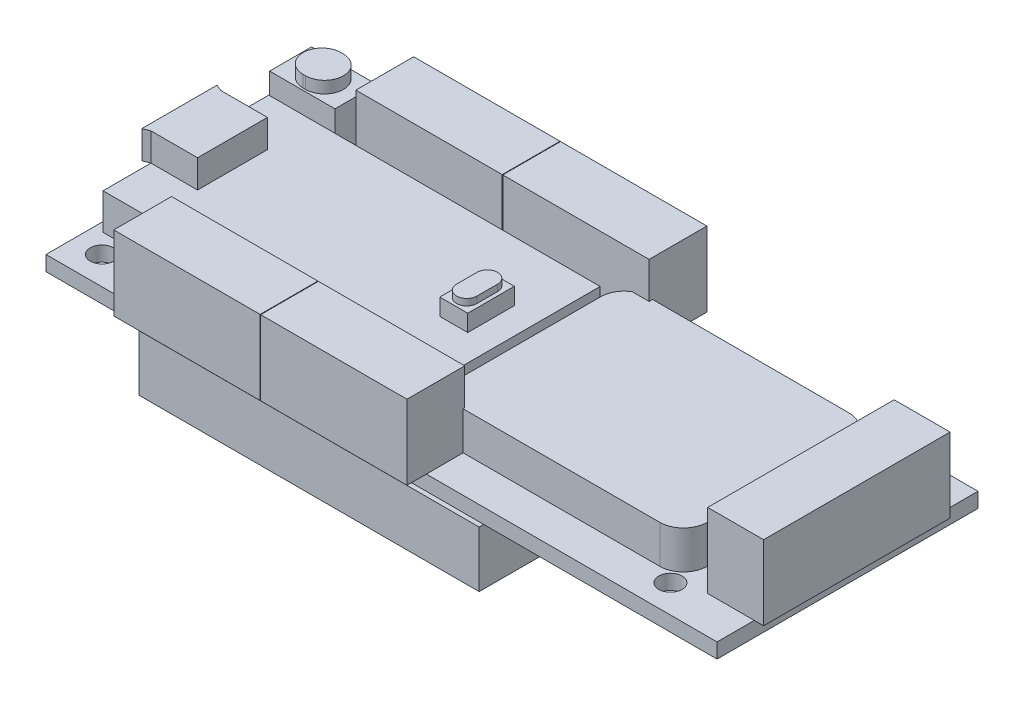
from build123d import *

# Parameters (mm, degrees)
SKETCH1_W            = 72
SKETCH1_H            = 28
SKETCH1_R            = 1.25
SKETCH1_R_2          = 0.5
BOSS_EXTRUDE1_DEPTH  = 1.6
SKETCH2_W            = 35.56
SKETCH2_H            = 17.78
BOSS_EXTRUDE2_DEPTH  = 3.86
BOSS_EXTRUDE3_DEPTH  = 3
SKETCH4_W            = 3
SKETCH4_H            = 5
BOSS_EXTRUDE4_DEPTH  = 1.8
BOSS_EXTRUDE5_DEPTH  = 0.7
BOSS_EXTRUDE6_DEPTH  = 4.09
SKETCH7_W            = 15.7
SKETCH7_H            = 6.2
BOSS_EXTRUDE7_DEPTH  = 8
SKETCH8_W            = 30
SKETCH8_H            = 13
BOSS_EXTRUDE8_DEPTH  = 1.5
SKETCH9_W            = 6
SKETCH9_H            = 20.007270078
BOSS_EXTRUDE9_DEPTH  = 8
SKETCH10_W           = 36.5
SKETCH10_H           = 29
BOSS_EXTRUDE10_DEPTH = 6
SKETCH12_W           = 7.01
SKETCH12_H           = 4.5
BOSS_EXTRUDE11_DEPTH = 5.79
BOSS_EXTRUDE12_DEPTH = 1.27


with BuildPart() as part:
    # Sketch1 → Boss-Extrude1 (new body)
    with BuildSketch(Plane(origin=(0, 0, 0), x_dir=(1, 0, 0), z_dir=(0, 1, 0))):
        Rectangle(SKETCH1_W, SKETCH1_H)
        with Locations(Location((-33, -11, 0), (0, 0, 270))):
            Circle(SKETCH1_R, mode=Mode.SUBTRACT)
        with Locations(Location((28, -11, 0), (0, 0, 270))):
            Circle(SKETCH1_R, mode=Mode.SUBTRACT)
        with Locations(Location((-30.96, 1.27, 0), (0, 0, 270))):
            Circle(SKETCH1_R_2, mode=Mode.SUBTRACT)
        with Locations(Location((28, 11, 0), (0, 0, 90))):
            Circle(SKETCH1_R, mode=Mode.SUBTRACT)
        with Locations(Location((-30.96, -1.27, 0), (0, 0, 90))):
            Circle(SKETCH1_R_2, mode=Mode.SUBTRACT)
    extrude(amount=BOSS_EXTRUDE1_DEPTH)

    # Sketch2 → Boss-Extrude2 (add)
    with BuildSketch(Plane(origin=(0, 1.6, 0), x_dir=(1, 0, 0), z_dir=(0, 1, 0))):
        with Locations((-17.22, 0.01)):
            Rectangle(SKETCH2_W, SKETCH2_H)
    extrude(amount=BOSS_EXTRUDE2_DEPTH)

    # Sketch3 → Boss-Extrude3 (add)
    with BuildSketch(Plane(origin=(0, 5.46, 0), x_dir=(1, 0, 0), z_dir=(0, 1, 0))):
        Polygon((-35, 3.76), (-30, 3.76), (-30, -3.74), (-35, -3.74), (-35.7, -4.02), (-35.7, 4.04), align=None)
    extrude(amount=BOSS_EXTRUDE3_DEPTH)

    # Sketch4 → Boss-Extrude4 (add)
    with BuildSketch(Plane(origin=(0, 5.46, 0), x_dir=(1, 0, 0), z_dir=(0, 1, 0))):
        with Locations((-3.76, 0.01)):
            Rectangle(SKETCH4_W, SKETCH4_H)
    extrude(amount=BOSS_EXTRUDE4_DEPTH)

    # Sketch5 → Boss-Extrude5 (add)
    with BuildSketch(Plane(origin=(0, 7.26, 0), x_dir=(1, 0, 0), z_dir=(0, 1, 0))):
        with BuildLine():
            Line((-2.66, 1.11), (-2.66, -1.09))
            ThreePointArc((-2.66, -1.09), (-3.76, -2.19), (-4.86, -1.09))
            Line((-4.86, -1.09), (-4.86, 1.11))
            ThreePointArc((-4.86, 1.11), (-3.76, 2.21), (-2.66, 1.11))
        make_face()
    extrude(amount=BOSS_EXTRUDE5_DEPTH)

    # Sketch6 → Boss-Extrude6 (add)
    with BuildSketch(Plane(origin=(0, 1.6, 0), x_dir=(1, 0, 0), z_dir=(0, 1, 0))):
        with BuildLine():
            Line((4.315, 10.27), (25.905, 10.27))
            ThreePointArc((25.905, 10.27), (27.701051224, 9.526051224), (28.445, 7.73))
            Line((28.445, 7.73), (28.445, -7.51))
            ThreePointArc((28.445, -7.51), (27.701051224, -9.306051224), (25.905, -10.05))
            Line((25.905, -10.05), (4.315, -10.05))
            ThreePointArc((4.315, -10.05), (2.518948776, -9.306051224), (1.775, -7.51))
            Line((1.775, -7.51), (1.775, 7.73))
            ThreePointArc((1.775, 7.73), (2.518948776, 9.526051224), (4.315, 10.27))
        make_face()
    extrude(amount=BOSS_EXTRUDE6_DEPTH)

    # Sketch7 → Boss-Extrude7 (add)
    with BuildSketch(Plane(origin=(0, 1.6, 0), x_dir=(1, 0, 0), z_dir=(0, 1, 0))):
        with Locations((-18.8, 13)):
            Rectangle(SKETCH7_W, SKETCH7_H)
        with Locations((-3.04, 13)):
            Rectangle(SKETCH7_W, SKETCH7_H)
        with Locations((-3.04, -12.98)):
            Rectangle(SKETCH7_W, SKETCH7_H)
        with Locations((-18.8, -12.98)):
            Rectangle(SKETCH7_W, SKETCH7_H)
    extrude(amount=BOSS_EXTRUDE7_DEPTH)

    # Sketch8 → Boss-Extrude8 (add)
    with BuildSketch(Plane(origin=(0, 0, 0), x_dir=(-1, 0, 0), z_dir=(0, -1, 0))):
        with Locations((-17.55, 0.22970015)):
            Rectangle(SKETCH8_W, SKETCH8_H)
    extrude(amount=BOSS_EXTRUDE8_DEPTH)

    # Sketch9 → Boss-Extrude9 (add)
    with BuildSketch(Plane(origin=(0, 1.6, 0), x_dir=(1, 0, 0), z_dir=(0, 1, 0))):
        with Locations((34, 0)):
            Rectangle(SKETCH9_W, SKETCH9_H)
    extrude(amount=BOSS_EXTRUDE9_DEPTH)

    # Sketch10 → Boss-Extrude10 (add)
    with BuildSketch(Plane(origin=(0, 0, 0), x_dir=(-1, 0, 0), z_dir=(0, -1, 0))):
        with Locations((7.281732971, 0.01)):
            Rectangle(SKETCH10_W, SKETCH10_H)
    extrude(amount=BOSS_EXTRUDE10_DEPTH)

    # Sketch12 → Boss-Extrude11 (add)
    with BuildSketch(Plane(origin=(0, 1.6, 0), x_dir=(1, 0, 0), z_dir=(0, 1, 0))):
        with Locations((-31.75, 11.5)):
            Rectangle(SKETCH12_W, SKETCH12_H)
    extrude(amount=BOSS_EXTRUDE11_DEPTH)

    # Sketch13 → Boss-Extrude12 (add)
    with BuildSketch(Plane(origin=(0, 7.39, 0), x_dir=(1, 0, 0), z_dir=(0, 1, 0))):
        with BuildLine():
            Line((-31.88, 13.53), (-31.62, 13.53))
            ThreePointArc((-31.62, 13.53), (-29.59, 11.5), (-31.62, 9.47))
            Line((-31.62, 9.47), (-31.88, 9.47))
            ThreePointArc((-31.88, 9.47), (-33.91, 11.5), (-31.88, 13.53))
        make_face()
    extrude(amount=BOSS_EXTRUDE12_DEPTH)


solid = part.part
